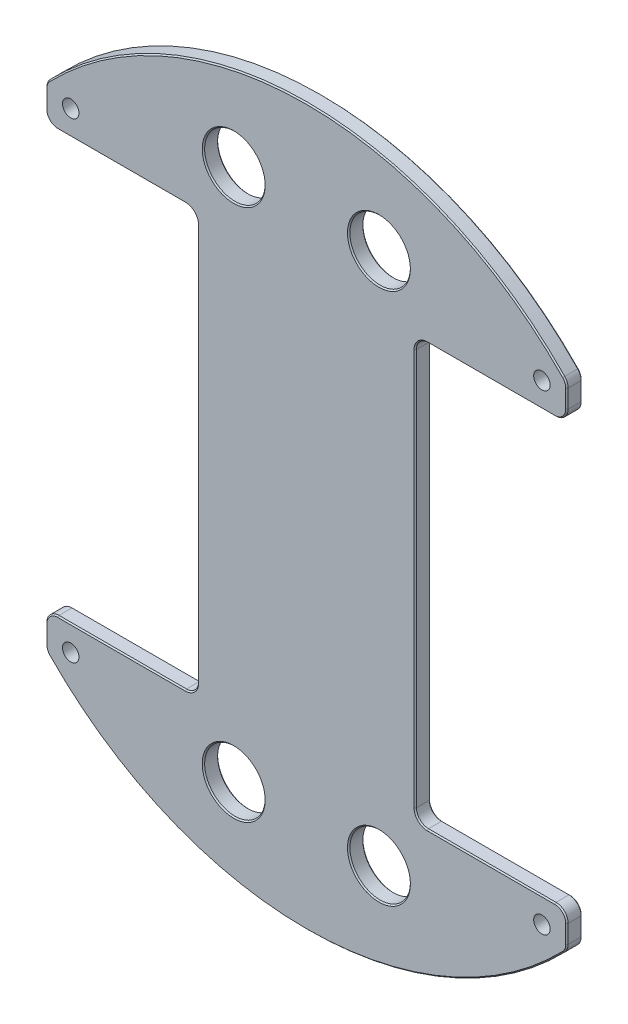
from build123d import *

# Parameters (mm, degrees)
BOSS_EXTRUDE1_DEPTH  = 3.175
M3_CLEARANCE_HOLE1_D = 3.4
SKETCH7_R            = 6.25
CUT_EXTRUDE3_DEPTH   = 92.569651758
FILLET1_R            = 2.5
CHAMFER1_SIZE        = 0.25


with BuildPart() as part:
    # Sketch1 → Boss-Extrude1 (new body)
    with BuildSketch(Plane.XY):
        with BuildLine():
            Line((-53.841624215, 50.764943631), (-53.841624215, 43.491624215))
            Line((-53.841624215, 43.491624215), (-22.5, 43.491624215))
            Line((-22.5, 43.491624215), (-22.5, -43.491624215))
            Line((-22.5, -43.491624215), (-53.841624215, -43.491624215))
            Line((-53.841624215, -43.491624215), (-53.841624215, -50.764943631))
            ThreePointArc((-53.841624215, -50.764943631), (0, -74), (53.841624215, -50.764943631))
            Line((53.841624215, -50.764943631), (53.841624215, -43.491624215))
            Line((53.841624215, -43.491624215), (22.5, -43.491624215))
            Line((22.5, -43.491624215), (22.5, 43.491624215))
            Line((22.5, 43.491624215), (53.841624215, 43.491624215))
            Line((53.841624215, 43.491624215), (53.841624215, 50.764943631))
            ThreePointArc((53.841624215, 50.764943631), (0, 74), (-53.841624215, 50.764943631))
        make_face()
    extrude(amount=BOSS_EXTRUDE1_DEPTH)

    # M3 Clearance Hole1 (through all)
    with Locations(Plane(origin=(48.666624215, 48.666624215, 0), x_dir=(-1, 0, 0), z_dir=(0, 0, -1))):
        with Locations((0, 0), (97.33324843, 0), (97.33324843, -97.33324843), (0, -97.33324843)):
            Hole(M3_CLEARANCE_HOLE1_D / 2)

    # Sketch7 → Cut-Extrude3 (cut, through all)
    with BuildSketch(Plane(origin=(0, 0, 0), x_dir=(-1, 0, 0), z_dir=(0, 0, -1))):
        with Locations((15, 55)):
            Circle(SKETCH7_R)
        with Locations(Location((-15, 55, 0), (0, 0, 180))):
            Circle(SKETCH7_R)
        with Locations((-15, -55)):
            Circle(SKETCH7_R)
        with Locations(Location((15, -55, 0), (0, 0, 180))):
            Circle(SKETCH7_R)
    extrude(amount=-CUT_EXTRUDE3_DEPTH, mode=Mode.SUBTRACT)

    # Fillet1
    fillet1_edges = [part.edges().sort_by_distance(p)[0] for p in [
        (53.841624215, 50.764943631, 1.5875),
        (53.841624215, 43.491624215, 1.5875),
        (22.5, 43.491624215, 1.5875),
        (22.5, -43.491624215, 1.5875),
        (53.841624215, -43.491624215, 1.5875),
        (53.841624215, -50.764943631, 1.5875),
        (-53.841624215, -50.764943631, 1.5875),
        (-53.841624215, -43.491624215, 1.5875),
        (-22.5, -43.491624215, 1.5875),
        (-22.5, 43.491624215, 1.5875),
        (-53.841624215, 43.491624215, 1.5875),
        (-53.841624215, 50.764943631, 1.5875),
    ]]
    fillet(fillet1_edges, radius=FILLET1_R)

    # Chamfer1
    chamfer1_edges = [part.edges().sort_by_distance(p)[0] for p in [
        (23.232233047, 42.759391168, 0),
        (23.232233047, 42.759391168, 3.175),
        (23.232233047, -42.759391168, 0),
        (23.232233047, -42.759391168, 3.175),
        (-23.232233047, -42.759391168, 0),
        (-23.232233047, -42.759391168, 3.175),
        (-23.232233047, 42.759391168, 0),
        (-23.232233047, 42.759391168, 3.175),
        (-21.25, -55, 3.175),
        (-21.25, -55, 0),
        (21.25, -55, 3.175),
        (21.25, -55, 0),
        (8.75, 55, 3.175),
        (8.75, 55, 0),
        (-8.75, 55, 3.175),
        (-8.75, 55, 0),
        (0, 74, 0),
        (0, 74, 3.175),
        (53.841624215, 47.876967743, 0),
        (38.170812108, 43.491624215, 0),
        (22.5, 0, 0),
        (38.170812108, -43.491624215, 0),
        (53.841624215, -47.876967743, 0),
        (0, -74, 0),
        (-53.841624215, -47.876967743, 0),
        (-38.170812108, -43.491624215, 0),
        (-22.5, 0, 0),
        (-38.170812108, 43.491624215, 0),
        (-53.841624215, 47.876967743, 0),
        (-53.65872415, -50.700952785, 0),
        (-53.65872415, 50.700952785, 0),
        (-53.109391168, 44.223857262, 0),
        (-53.109391168, -44.223857262, 0),
        (53.65872415, -50.700952785, 0),
        (53.109391168, -44.223857262, 0),
        (53.109391168, 44.223857262, 0),
        (53.65872415, 50.700952785, 0),
        (53.841624215, 47.876967743, 3.175),
        (-53.841624215, 47.876967743, 3.175),
        (-38.170812108, 43.491624215, 3.175),
        (-22.5, 0, 3.175),
        (-38.170812108, -43.491624215, 3.175),
        (-53.841624215, -47.876967743, 3.175),
        (0, -74, 3.175),
        (53.841624215, -47.876967743, 3.175),
        (38.170812108, -43.491624215, 3.175),
        (22.5, 0, 3.175),
        (38.170812108, 43.491624215, 3.175),
        (-53.65872415, -50.700952785, 3.175),
        (-53.65872415, 50.700952785, 3.175),
        (-53.109391168, 44.223857262, 3.175),
        (-53.109391168, -44.223857262, 3.175),
        (53.65872415, -50.700952785, 3.175),
        (53.109391168, -44.223857262, 3.175),
        (53.109391168, 44.223857262, 3.175),
        (53.65872415, 50.700952785, 3.175),
    ]]
    chamfer(chamfer1_edges, length=CHAMFER1_SIZE)


solid = part.part
